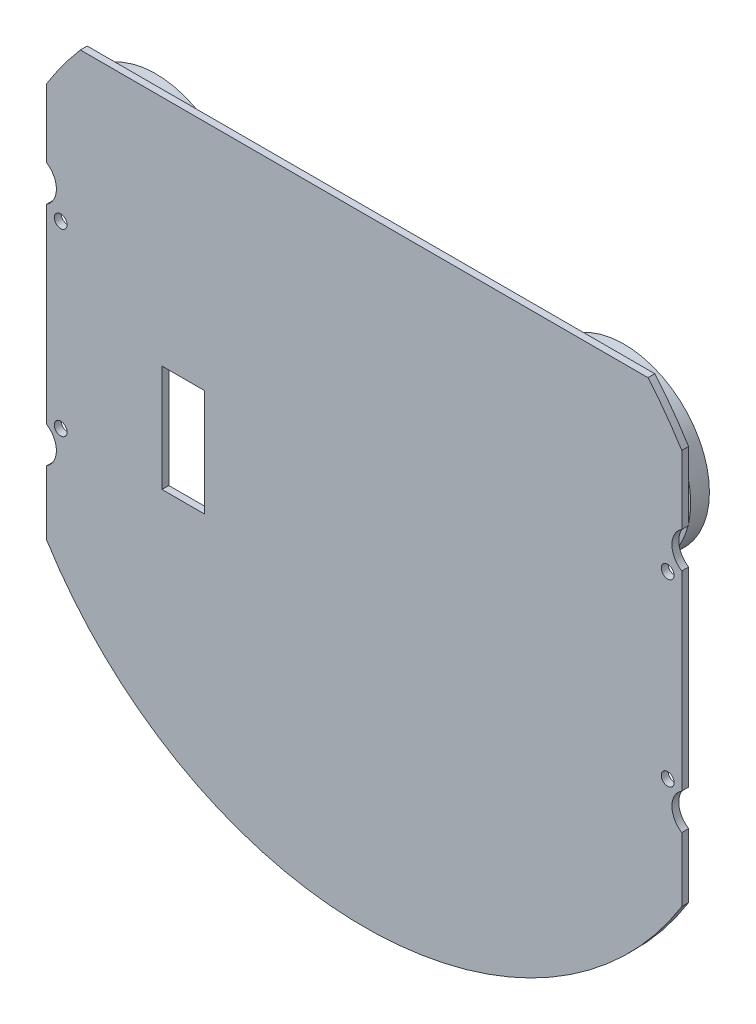
from build123d import *

# Parameters (mm, degrees)
SKETCH_1_R           = 25
SKETCH_1_R_2         = 20
EXTRUDE_1_DEPTH      = 1.6
EXTRUDE_START        = -6
SKETCH_4_R           = 20
SKETCH_4_R_2         = 25
EXTRUDE_2_DEPTH      = 6
SKETCH_5_OUTSIDE_W   = 222.406
SKETCH_5_OUTSIDE_H   = 191.906
SKETCH_5_OUTSIDE_W_2 = 148.6
SKETCH_5_OUTSIDE_H_2 = 200
CUT_EXTRUDE_1_DEPTH  = 10
SKETCH_6_R           = 5
CUT_EXTRUDE_2_DEPTH  = 10
SKETCH_8_W           = 10
SKETCH_8_H           = 25
CUT_EXTRUDE_4_DEPTH  = 10
SKETCH_9_R           = 1.5
CUT_EXTRUDE_5_DEPTH  = 116.180128425


with BuildPart() as part:
    # 草图1 → 凸台-拉伸1 (new body)
    with BuildSketch(Plane.XY):
        with BuildLine():
            Line((-66.387122245, 57), (66.387122245, 57))
            ThreePointArc((66.387122245, 57), (0, -87.5), (-66.387122245, 57))
        make_face()
        Circle(SKETCH_1_R, mode=Mode.SUBTRACT)
        with Locations((54.772, 35)):
            Circle(SKETCH_1_R_2, mode=Mode.SUBTRACT)
        with Locations(Location((-54.772, 35, 0), (0, 0, 180))):
            Circle(SKETCH_1_R_2, mode=Mode.SUBTRACT)
        with Locations((35, -54.772)):
            Circle(SKETCH_1_R_2, mode=Mode.SUBTRACT)
        with Locations((-35, -54.772)):
            Circle(SKETCH_1_R_2, mode=Mode.SUBTRACT)
    extrude(amount=EXTRUDE_1_DEPTH)

    # 草图4 → 凸台-拉伸2 (add)
    with BuildSketch(Plane.XY.offset(1.6).offset(EXTRUDE_START)):
        with Locations((-54.772, 35)):
            Circle(SKETCH_4_R)
        Circle(SKETCH_4_R_2)
        with Locations((54.772, 35)):
            Circle(SKETCH_4_R)
        with Locations((-35, -54.772)):
            Circle(SKETCH_4_R)
        with Locations((35, -54.772)):
            Circle(SKETCH_4_R)
    extrude(amount=EXTRUDE_2_DEPTH)

    # 草图5 outside → 切除-拉伸1 (cut)
    with BuildSketch(Plane(origin=(0, 0, 0), x_dir=(-1, 0, 0), z_dir=(0, 0, -1))):
        with Locations((0, -15.25)):
            Rectangle(SKETCH_5_OUTSIDE_W, SKETCH_5_OUTSIDE_H)
        Rectangle(SKETCH_5_OUTSIDE_W_2, SKETCH_5_OUTSIDE_H_2, mode=Mode.SUBTRACT)
    extrude(amount=-CUT_EXTRUDE_1_DEPTH, mode=Mode.SUBTRACT)

    # 草图6 → 切除-拉伸2 (cut)
    with BuildSketch(Plane(origin=(0, 0, 0), x_dir=(-1, 0, 0), z_dir=(0, 0, -1))):
        with Locations((-77, -27)):
            Circle(SKETCH_6_R)
        with Locations((-77, 26)):
            Circle(SKETCH_6_R)
        with Locations((77, 26)):
            Circle(SKETCH_6_R)
        with Locations((77, -27)):
            Circle(SKETCH_6_R)
    extrude(amount=-CUT_EXTRUDE_2_DEPTH, mode=Mode.SUBTRACT)

    # 草图8 → 切除-拉伸4 (cut)
    with BuildSketch(Plane.XY.offset(1.6)):
        with Locations((-42.3, -10)):
            Rectangle(SKETCH_8_W, SKETCH_8_H)
    extrude(amount=-CUT_EXTRUDE_4_DEPTH, mode=Mode.SUBTRACT)

    # 草图9 → 切除-拉伸5 (cut, through all)
    with BuildSketch(Plane(origin=(0, 0, 0), x_dir=(-1, 0, 0), z_dir=(0, 0, -1))):
        with Locations((-71, 20)):
            Circle(SKETCH_9_R)
        with Locations((-71, -22)):
            Circle(SKETCH_9_R)
        with Locations((71, 20)):
            Circle(SKETCH_9_R)
        with Locations((71, -22)):
            Circle(SKETCH_9_R)
    extrude(amount=-CUT_EXTRUDE_5_DEPTH, mode=Mode.SUBTRACT)


solid = part.part
